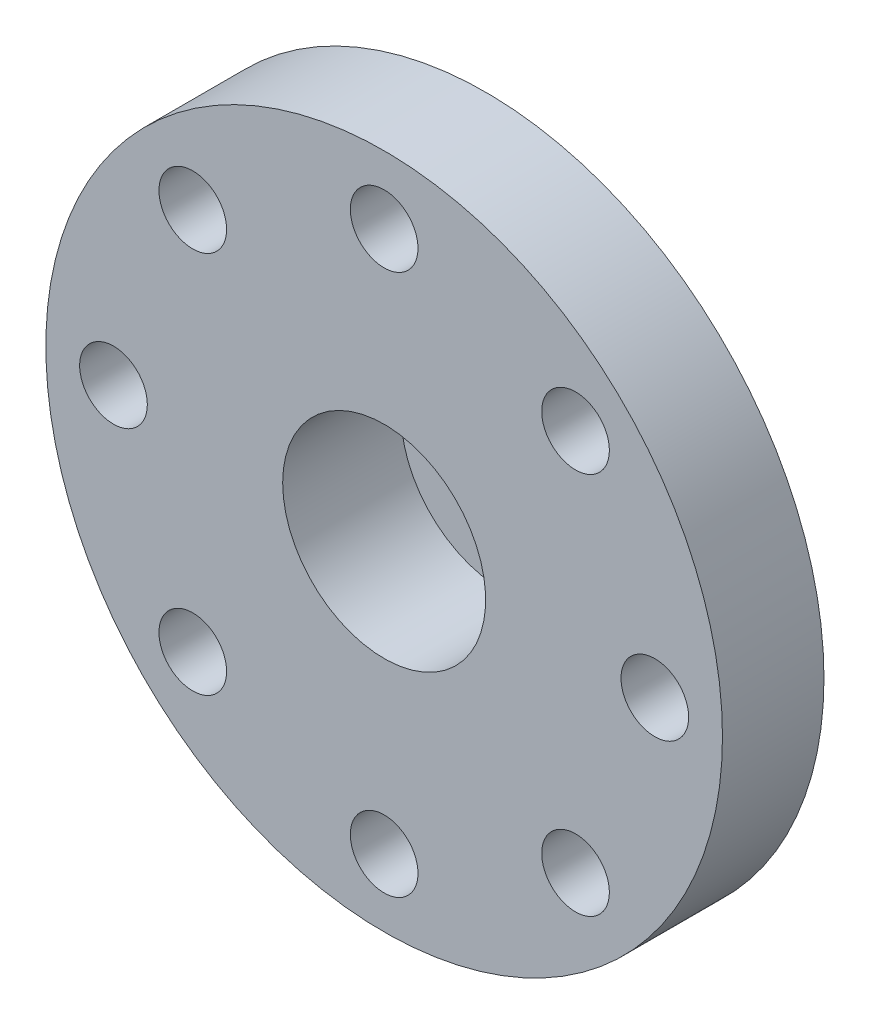
from build123d import *

# Parameters (mm, degrees)
SKETCH_1_R          = 10
SKETCH_1_R_2        = 1.5
SKETCH_1_R_3        = 1
EXTRUDE_1_DEPTH     = 3
SKETCH_2_R          = 4.5
EXTRUDE_2_DEPTH     = 2
SKETCH_3_R          = 3
CUT_EXTRUDE_1_DEPTH = 3.5
SKETCH_4_R          = 1.5
CUT_EXTRUDE_2_DEPTH = 10


with BuildPart() as part:
    # 草图1 → 凸台-拉伸1 (new body)
    with BuildSketch(Plane.XY):
        Circle(SKETCH_1_R)
        Circle(SKETCH_1_R_2, mode=Mode.SUBTRACT)
        with Locations((0, 8)):
            Circle(SKETCH_1_R_3, mode=Mode.SUBTRACT)
        with Locations((5.656854249, 5.656854249)):
            Circle(SKETCH_1_R_3, mode=Mode.SUBTRACT)
        with Locations((8, 0)):
            Circle(SKETCH_1_R_3, mode=Mode.SUBTRACT)
        with Locations((5.656854249, -5.656854249)):
            Circle(SKETCH_1_R_3, mode=Mode.SUBTRACT)
        with Locations((0, -8)):
            Circle(SKETCH_1_R_3, mode=Mode.SUBTRACT)
        with Locations((-5.656854249, -5.656854249)):
            Circle(SKETCH_1_R_3, mode=Mode.SUBTRACT)
        with Locations((-8, 0)):
            Circle(SKETCH_1_R_3, mode=Mode.SUBTRACT)
        with Locations((-5.656854249, 5.656854249)):
            Circle(SKETCH_1_R_3, mode=Mode.SUBTRACT)
    extrude(amount=EXTRUDE_1_DEPTH)

    # 草图2 → 凸台-拉伸2 (add)
    with BuildSketch(Plane(origin=(0, 0, 0), x_dir=(-1, 0, 0), z_dir=(0, 0, -1))):
        with Locations(Location((0, 0, 0), (0, 0, 180))):
            Circle(SKETCH_2_R)
    extrude(amount=EXTRUDE_2_DEPTH)

    # 草图3 → 切除-拉伸1 (cut)
    with BuildSketch(Plane(origin=(0, 0, 3), x_dir=(-1, 0, 0), z_dir=(0, 0, -1))):
        Circle(SKETCH_3_R)
    extrude(amount=CUT_EXTRUDE_1_DEPTH, mode=Mode.SUBTRACT)

    # 草图4 → 切除-拉伸2 (cut)
    with BuildSketch(Plane(origin=(0, 0, -2), x_dir=(-1, 0, 0), z_dir=(0, 0, -1))):
        Circle(SKETCH_4_R)
    extrude(amount=-CUT_EXTRUDE_2_DEPTH, mode=Mode.SUBTRACT)


solid = part.part
